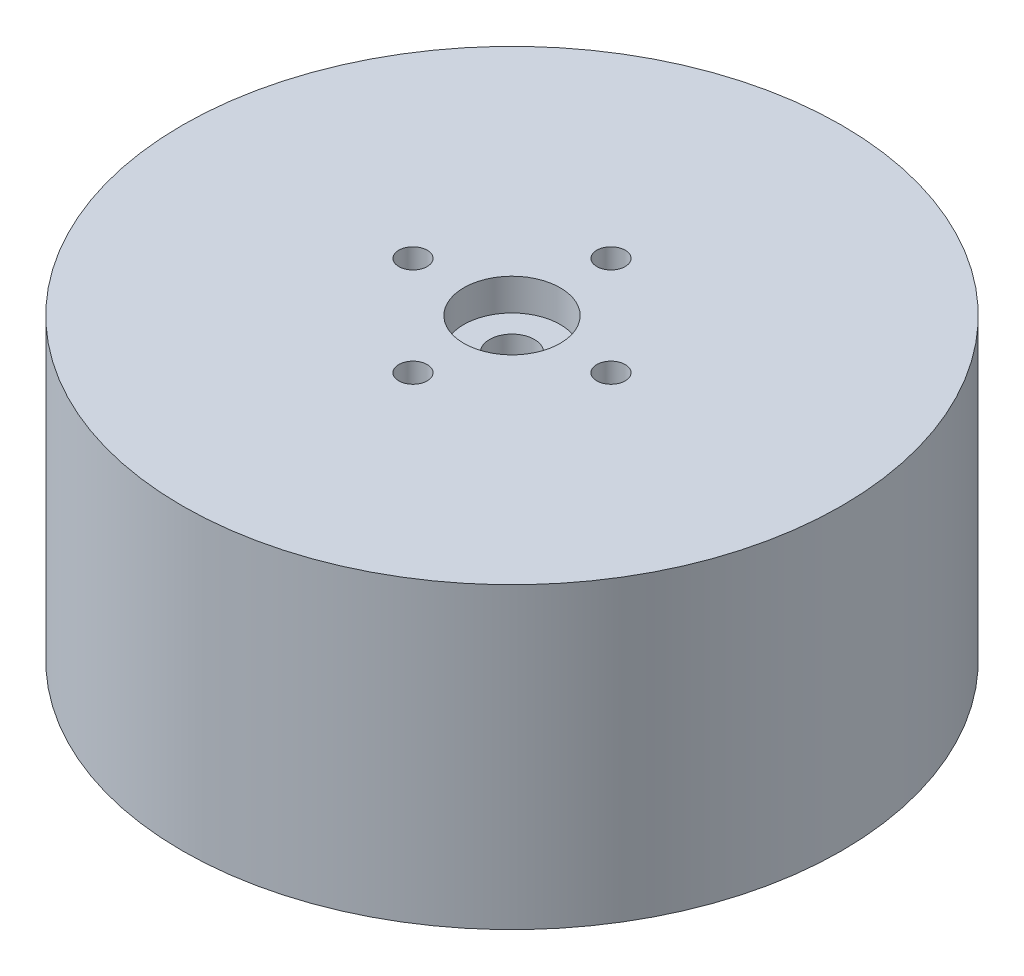
from build123d import *

# Parameters (mm, degrees)
SKETCH1_R           = 38.3
BOSS_EXTRUDE1_DEPTH = 34.7
SKETCH2_R           = 2.6
CUT_EXTRUDE2_DEPTH  = 34.7
SKETCH4_R           = 5.6
CUT_EXTRUDE3_DEPTH  = 3.7
CUT_EXTRUDE4_START  = -3.7
SKETCH5_R           = 5.6
CUT_EXTRUDE4_DEPTH  = 3.7
SKETCH6_R           = 1.65
CUT_EXTRUDE5_DEPTH  = 65.326277679


with BuildPart() as part:
    # Sketch1 → Boss-Extrude1 (new body)
    with BuildSketch(Plane(origin=(0, 0, 0), x_dir=(1, 0, 0), z_dir=(0, 1, 0))):
        with Locations(Location((0, 0, 0), (0, 0, 270))):
            Circle(SKETCH1_R)
    extrude(amount=BOSS_EXTRUDE1_DEPTH)

    # Sketch2 → Cut-Extrude2 (cut)
    with BuildSketch(Plane.XZ):
        with Locations(Location((0, 0, 0), (0, 0, 270))):
            Circle(SKETCH2_R)
    extrude(amount=-CUT_EXTRUDE2_DEPTH, mode=Mode.SUBTRACT)

    # Sketch4 → Cut-Extrude3 (cut)
    with BuildSketch(Plane.XZ):
        with Locations(Location((0, 0, 0), (0, 0, 270))):
            Circle(SKETCH4_R)
    extrude(amount=-CUT_EXTRUDE3_DEPTH, mode=Mode.SUBTRACT)

    # Sketch5 → Cut-Extrude4 (cut)
    with BuildSketch(Plane(origin=(0, 34.7, 0), x_dir=(1, 0, 0), z_dir=(0, 1, 0)).offset(CUT_EXTRUDE4_START)):
        with Locations(Location((0, 0, 0), (0, 0, 90))):
            Circle(SKETCH5_R)
    extrude(amount=CUT_EXTRUDE4_DEPTH, mode=Mode.SUBTRACT)

    # Sketch6 → Cut-Extrude5 (cut, through all)
    with BuildSketch(Plane(origin=(0, 34.7, 0), x_dir=(1, 0, 0), z_dir=(0, 1, 0))):
        with Locations(Location((0, 11.5, 0), (0, 0, 270))):
            Circle(SKETCH6_R)
        with Locations(Location((11.5, 0, 0), (0, 0, 270))):
            Circle(SKETCH6_R)
        with Locations(Location((0, -11.5, 0), (0, 0, 270))):
            Circle(SKETCH6_R)
        with Locations(Location((-11.5, 0, 0), (0, 0, 270))):
            Circle(SKETCH6_R)
    extrude(amount=-CUT_EXTRUDE5_DEPTH, mode=Mode.SUBTRACT)


solid = part.part
